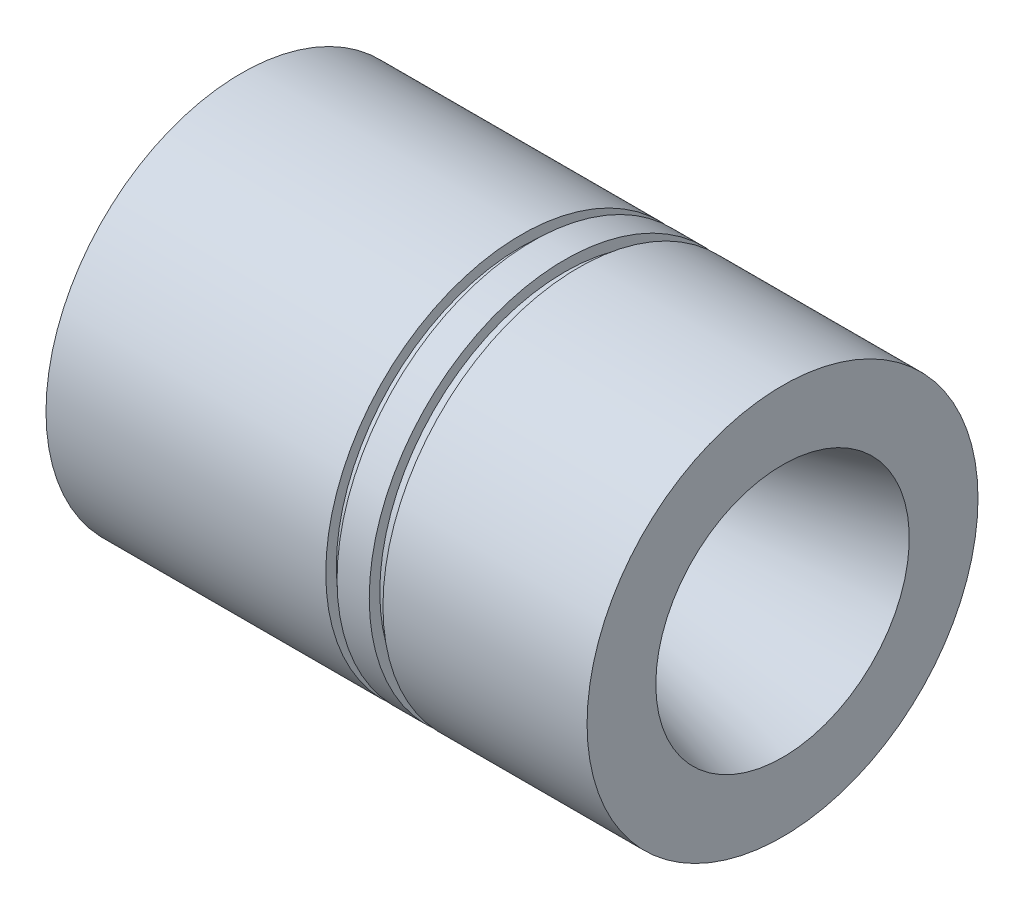
from build123d import *


with BuildPart() as part:
    # Sketch1 → Revolve1 (revolve)
    with BuildSketch(Plane.XY, mode=Mode.PRIVATE) as revolve1_sk:
        with BuildLine():
            Line((43.421005762, 29.901440031), (63.302799643, 18.422680981))
            ThreePointArc((63.302799643, 18.422680981), (68.543849717, 16.213738545), (74.168, 15.367))
            ThreePointArc((74.168, 15.367), (75.003256616, 15.406217174), (75.824358548, 15.564277983))
            Line((75.824358548, 15.564277983), (140.97, 33.02))
            Line((140.97, 33.02), (140.97, 50.927))
            Line((140.97, 50.927), (87.788503876, 50.927))
            Line((87.788503876, 50.927), (87.788503876, 48.180233369))
            Line((87.788503876, 48.180233369), (84.218492297, 48.180233369))
            Line((84.218492297, 48.180233369), (84.218492297, 50.927))
            Line((84.218492297, 50.927), (75.824358548, 50.927))
            Line((75.824358548, 50.927), (75.824358548, 48.180233369))
            Line((75.824358548, 48.180233369), (72.892938323, 48.180233369))
            Line((72.892938323, 48.180233369), (72.892938323, 50.927))
            Line((72.892938323, 50.927), (0, 50.927))
            Line((0, 50.927), (0, 41.402))
            ThreePointArc((0, 41.402), (22.475975666, 38.541805218), (43.421005762, 29.901440031))
        make_face()
    revolve(revolve1_sk.sketch.rotate(Axis((0, 0, 0), (1, 0, 0)), 90), axis=Axis((0, 0, 0), (1, 0, 0)))


solid = part.part
